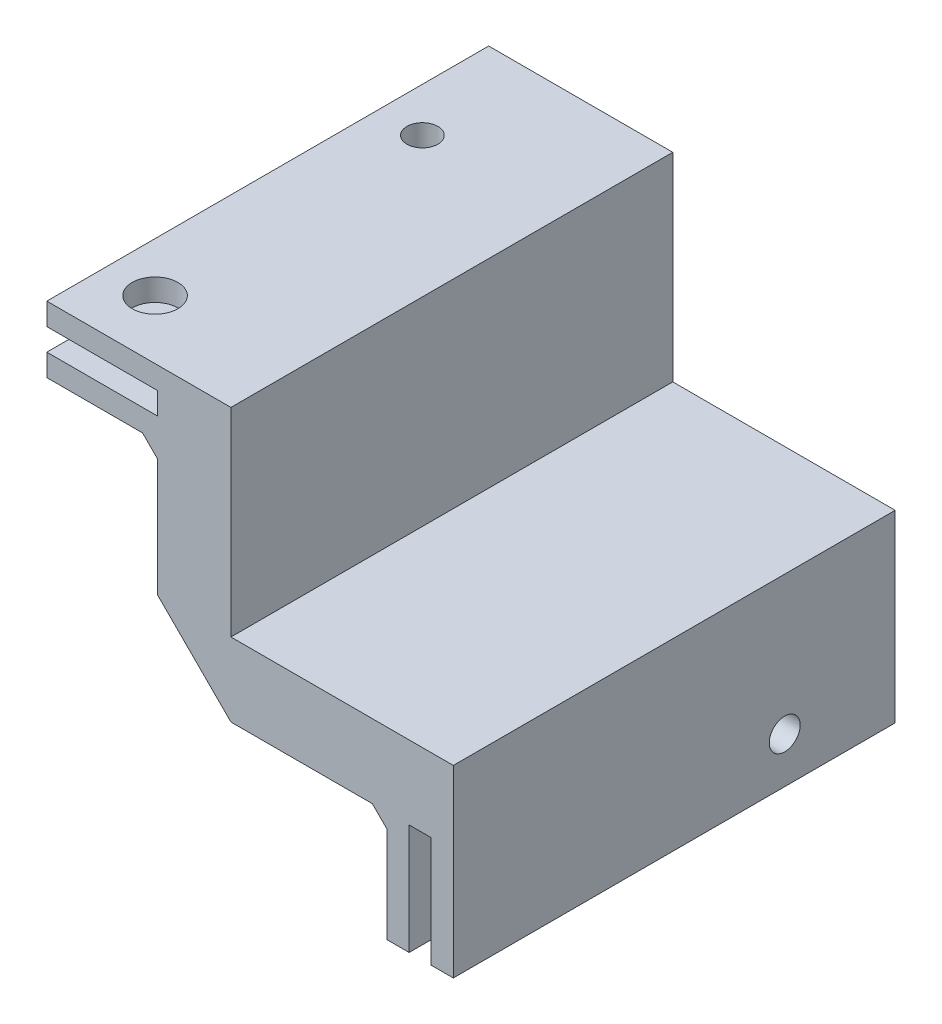
from build123d import *

# Parameters (mm, degrees)
DODANIE_WYCI_GNI_CIE1_DEPTH = 60
SFAZOWANIE1_SIZE            = 2
SZKIC2_R                    = 3.1
WYTNIJ_WYCI_GNI_CIE1_DEPTH  = 10
SZKIC3_R                    = 2.1
WYTNIJ_WYCI_GNI_CIE2_DEPTH  = 10
SZKIC4_R                    = 2.1
WYTNIJ_WYCI_GNI_CIE3_DEPTH  = 10


with BuildPart() as part:
    # Szkic1 → Dodanie-wyciągnięcie1 (new body)
    with BuildSketch(Plane.XY):
        Polygon((0, 0), (-3, 0), (-3, 15), (-6, 15), (-6, 0), (-9, 0), (-9, 15), (-30.2, 15), (-40.2, 25), (-40.2, 43), (-55.2, 43), (-55.2, 46), (-40.2, 46), (-40.2, 49), (-55.2, 49), (-55.2, 52), (-30.2, 52), (-30.2, 25), (0, 25), align=None)
    extrude(amount=DODANIE_WYCI_GNI_CIE1_DEPTH)

    # Sfazowanie1
    sfazowanie1_edges = [part.edges().sort_by_distance(p)[0] for p in [
        (-9, 15, 30),
        (-40.2, 43, 30),
    ]]
    chamfer(sfazowanie1_edges, length=SFAZOWANIE1_SIZE)

    # Szkic2 → Wytnij-wyciągnięcie1 (cut)
    with BuildSketch(Plane.XZ.offset(-43)):
        with Locations(Location((-48.5, 52, 0), (0, 0, 270))):
            Circle(SZKIC2_R)
    extrude(amount=-WYTNIJ_WYCI_GNI_CIE1_DEPTH, mode=Mode.SUBTRACT)

    # Szkic3 → Wytnij-wyciągnięcie2 (cut)
    with BuildSketch(Plane.XZ.offset(-43)):
        with Locations(Location((-49.2, 15, 0), (0, 0, 270))):
            Circle(SZKIC3_R)
    extrude(amount=-WYTNIJ_WYCI_GNI_CIE2_DEPTH, mode=Mode.SUBTRACT)

    # Szkic4 → Wytnij-wyciągnięcie3 (cut)
    with BuildSketch(Plane.ZY.offset(9)):
        with Locations((15, 6.2)):
            Circle(SZKIC4_R)
    extrude(amount=-WYTNIJ_WYCI_GNI_CIE3_DEPTH, mode=Mode.SUBTRACT)


solid = part.part
